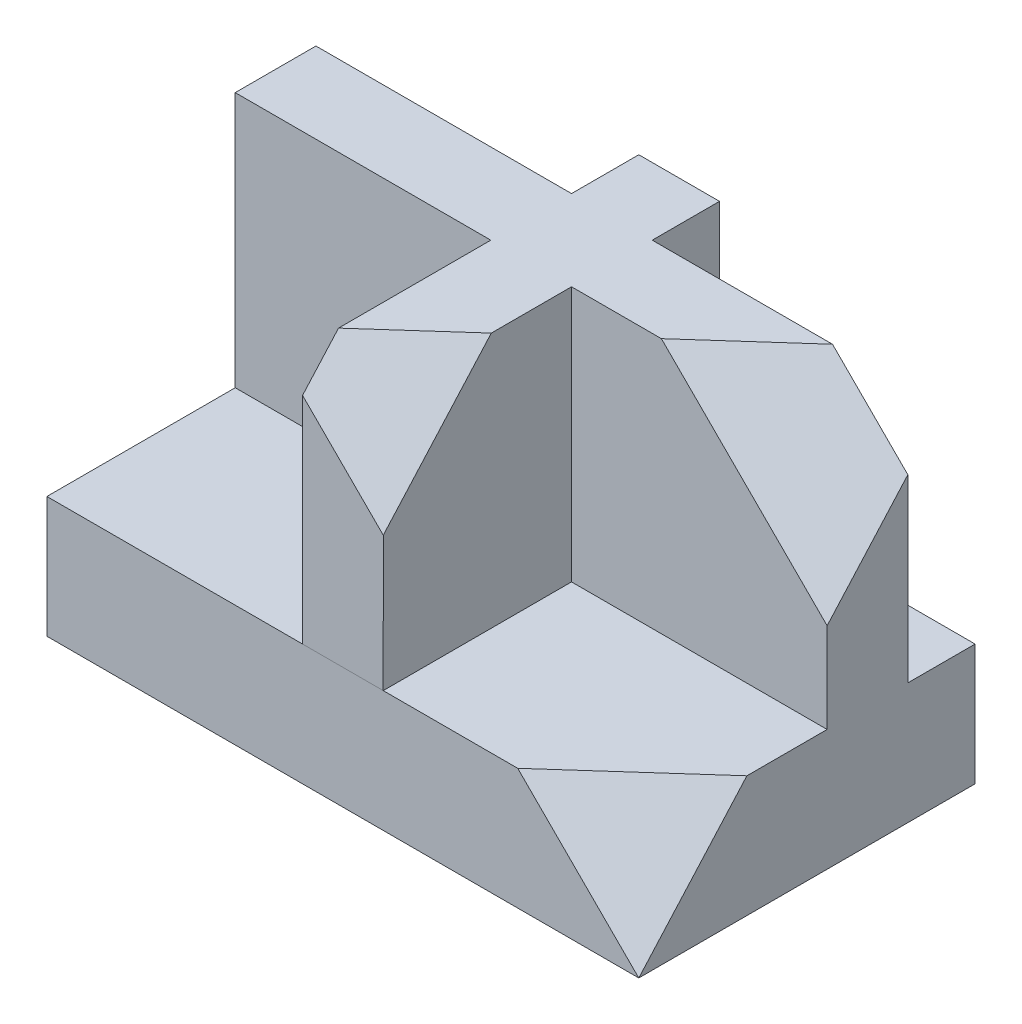
from build123d import *

# Parameters (mm, degrees)
SKETCH1_W           = 88
SKETCH1_H           = 50
BOSS_EXTRUDE1_DEPTH = 18
BOSS_EXTRUDE2_DEPTH = 38
SKETCH5_W           = 74.105007355
SKETCH5_H           = 76.56039949
CUT_EXTRUDE1_DEPTH  = 38


with BuildPart() as part:
    # Sketch1 → Boss-Extrude1 (new body)
    with BuildSketch(Plane(origin=(0, 0, 0), x_dir=(1, 0, 0), z_dir=(0, 1, 0))):
        Rectangle(SKETCH1_W, SKETCH1_H)
    extrude(amount=BOSS_EXTRUDE1_DEPTH)

    # Sketch2 → Boss-Extrude2 (add)
    with BuildSketch(Plane(origin=(0, 18, 0), x_dir=(1, 0, 0), z_dir=(0, 1, 0))):
        Polygon((-44, 3), (-6, 3), (-6, -24.990461848), (6, -24.990461848), (6, 3), (44, 3), (44, 15), (6, 15), (6, 25), (-6, 25), (-6, 15), (-44, 15), align=None)
    extrude(amount=BOSS_EXTRUDE2_DEPTH)

    # Sketch5 → Cut-Extrude1 (cut)
    with BuildSketch(Plane(origin=(22.123893805, 22.123893805, 24.778761062), x_dir=(-0.8323002445923469, 0.36918924973045525, 0.4134919596981098), z_dir=(-0.5543250876981122, -0.5543250876981184, -0.6208440982218917))):
        with Locations((7.332126574, 18.101961107)):
            Rectangle(SKETCH5_W, SKETCH5_H)
    extrude(amount=-CUT_EXTRUDE1_DEPTH, mode=Mode.SUBTRACT)


solid = part.part
